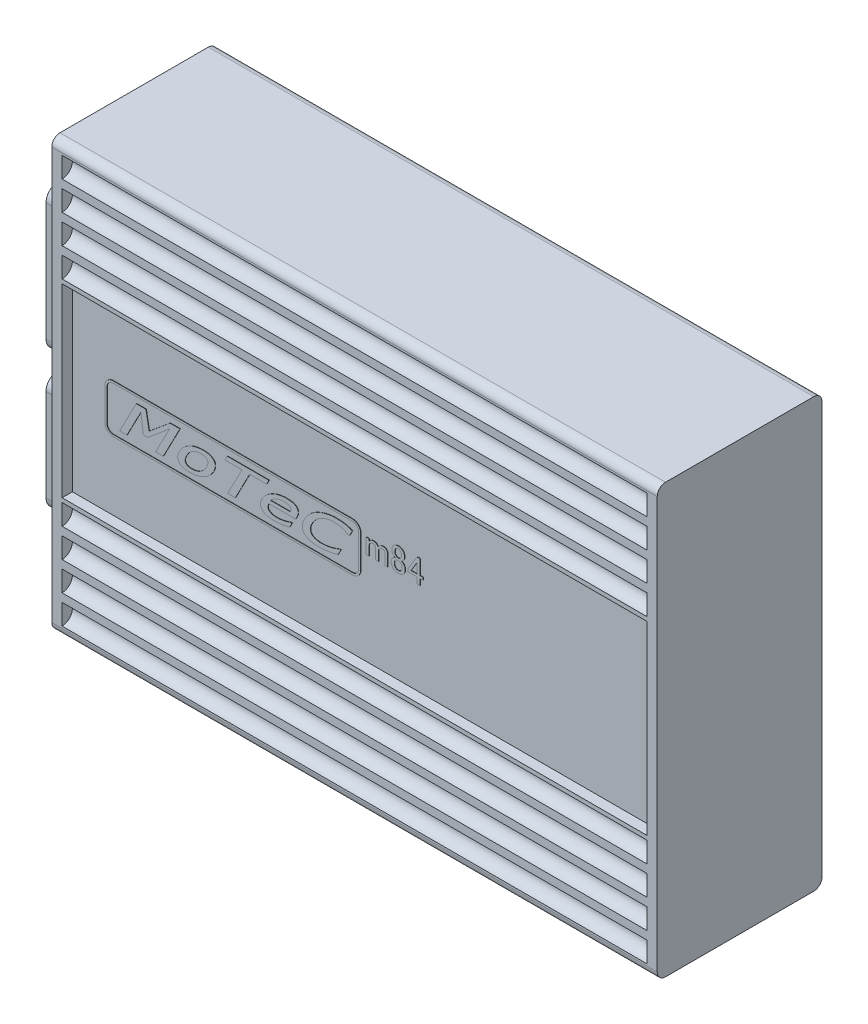
from build123d import *

# Parameters (mm, degrees)
SKETCH_1_W          = 147
SKETCH_1_H          = 104
EXTRUDE_1_DEPTH     = 40
FILLET_1_R          = 2
SKETCH_5_W          = 147
SKETCH_5_H          = 45
CUT_EXTRUDE_1_DEPTH = 2.5
CUT_EXTRUDE_2_DEPTH = 161.975153362
SKETCH_7_W          = 147
SKETCH_7_H          = 45
CUT_EXTRUDE_3_DEPTH = 2.5
EXTRUDE_4_DEPTH     = 2.5
EXTRUDE_5_DEPTH     = 2.5
EXTRUDE_6_DEPTH     = 0.1
EXTRUDE_7_DEPTH     = 0.1
SKETCH_12_W         = 23.8
SKETCH_12_H         = 34.7
SKETCH_12_H_2       = 28.4
EXTRUDE_8_DEPTH     = 7.4
SKETCH_14_W         = 19.8
SKETCH_14_H         = 30.7
CUT_EXTRUDE_4_DEPTH = 20
SKETCH_15_W         = 19.8
SKETCH_15_H         = 24.4
CUT_EXTRUDE_5_DEPTH = 20
FILLET_3_R          = 3


with BuildPart() as part:
    # ｽｹｯﾁ1 → ﾎﾞｽ - 押し出し1 (new body)
    with BuildSketch(Plane.XY):
        Rectangle(SKETCH_1_W, SKETCH_1_H)
    extrude(amount=EXTRUDE_1_DEPTH)

    # ﾌｨﾚｯﾄ1
    fillet_1_edges = [part.edges().sort_by_distance(p)[0] for p in [
        (0, -52, 40),
        (0, -52, 0),
        (0, 52, 0),
        (0, 52, 40),
    ]]
    fillet(fillet_1_edges, radius=FILLET_1_R)

    # ｽｹｯﾁ5 → ｶｯﾄ - 押し出し1 (cut)
    with BuildSketch(Plane(origin=(0, 0, 0), x_dir=(-1, 0, 0), z_dir=(0, 0, -1))):
        Rectangle(SKETCH_5_W, SKETCH_5_H)
    extrude(amount=-CUT_EXTRUDE_1_DEPTH, mode=Mode.SUBTRACT)

    # ｽｹｯﾁ6 → ｶｯﾄ - 押し出し2 (cut, through all)
    with BuildSketch(Plane.ZY.offset(73.5)):
        with BuildLine():
            Line((0, 49.5), (0, 44.5))
            ThreePointArc((0, 44.5), (2.5, 47), (0, 49.5))
        make_face()
        with BuildLine():
            Line((0, 42.5), (0, 37.5))
            ThreePointArc((0, 37.5), (2.5, 40), (0, 42.5))
        make_face()
        with BuildLine():
            Line((0, 35.5), (0, 30.5))
            ThreePointArc((0, 30.5), (2.5, 33), (0, 35.5))
        make_face()
        with BuildLine():
            Line((0, 28.5), (0, 23.5))
            ThreePointArc((0, 23.5), (2.5, 26), (0, 28.5))
        make_face()
        with BuildLine():
            Line((40, 28.5), (40, 23.5))
            ThreePointArc((40, 23.5), (37.5, 26), (40, 28.5))
        make_face()
        with BuildLine():
            Line((40, 35.5), (40, 30.5))
            ThreePointArc((40, 30.5), (37.5, 33), (40, 35.5))
        make_face()
        with BuildLine():
            Line((40, 42.5), (40, 37.5))
            ThreePointArc((40, 37.5), (37.5, 40), (40, 42.5))
        make_face()
        with BuildLine():
            Line((40, 49.5), (40, 44.5))
            ThreePointArc((40, 44.5), (37.5, 47), (40, 49.5))
        make_face()
    cut_extrude_2 = extrude(amount=-CUT_EXTRUDE_2_DEPTH, mode=Mode.SUBTRACT)

    # ﾐﾗｰ1: ｶｯﾄ - 押し出し2 across plane
    add(cut_extrude_2.mirror(Plane.ZX), mode=Mode.SUBTRACT)

    # ｽｹｯﾁ7 → ｶｯﾄ - 押し出し3 (cut)
    with BuildSketch(Plane.XY.offset(40)):
        Rectangle(SKETCH_7_W, SKETCH_7_H)
    extrude(amount=-CUT_EXTRUDE_3_DEPTH, mode=Mode.SUBTRACT)

    # ｽｹｯﾁ8 → ﾎﾞｽ - 押し出し4 (add)
    with BuildSketch(Plane.ZY.offset(73.5)):
        with BuildLine():
            Line((2, -52), (38, -52))
            ThreePointArc((38, -52), (39.414213562, -51.414213562), (40, -50))
            Line((40, -50), (40, 50))
            ThreePointArc((40, 50), (39.414213562, 51.414213562), (38, 52))
            Line((38, 52), (2, 52))
            ThreePointArc((2, 52), (0.585786438, 51.414213562), (0, 50))
            Line((0, 50), (0, -50))
            ThreePointArc((0, -50), (0.585786438, -51.414213562), (2, -52))
        make_face()
    extrude(amount=-EXTRUDE_4_DEPTH)

    # ｽｹｯﾁ9 → ﾎﾞｽ - 押し出し5 (add)
    with BuildSketch(Plane(origin=(73.5, 0, 0), x_dir=(0, 0, -1), z_dir=(1, 0, 0))):
        with BuildLine():
            Line((-38, -52), (-2, -52))
            ThreePointArc((-2, -52), (-0.585786438, -51.414213562), (0, -50))
            Line((0, -50), (0, 50))
            ThreePointArc((0, 50), (-0.585786438, 51.414213562), (-2, 52))
            Line((-2, 52), (-38, 52))
            ThreePointArc((-38, 52), (-39.414213562, 51.414213562), (-40, 50))
            Line((-40, 50), (-40, -50))
            ThreePointArc((-40, -50), (-39.414213562, -51.414213562), (-38, -52))
        make_face()
    extrude(amount=-EXTRUDE_5_DEPTH)

    # ｽｹｯﾁ11 → ﾎﾞｽ - 押し出し6 (add)
    # profile 1 of 3: a face of its own
    with BuildSketch(Plane.XY.offset(37.5)):
        with BuildLine():
            Line((1.144144144, 0.098069498), (0.447971781, 0.098069498))
            Line((0.447971781, 0.098069498), (0.447971781, 3.759330759))
            Line((0.447971781, 3.759330759), (1.144144144, 3.759330759))
            Line((1.144144144, 3.759330759), (1.144144144, 3.203603604))
            add(Edge.make_bspline(
                [(1.144144144, 3.203603604), (1.209094475, 3.300576984), (1.316490685, 3.432401394), (1.476128806, 3.58323051), (1.598188132, 3.67094831), (1.723684656, 3.739797755), (1.896496282, 3.805448376), (2.033643976, 3.824764595), (2.124839125, 3.824710425)],
                knots=[0, 0, 0, 0, 0.289076243, 0.420055779, 0.543346146, 0.660648957, 0.774006625, 1, 1, 1, 1], degree=3))
            add(Edge.make_bspline(
                [(2.124839125, 3.824710425), (2.222453162, 3.825502434), (2.365318527, 3.815397975), (2.547538805, 3.781292301), (2.671391328, 3.746176063), (2.785948421, 3.70006945), (2.925267534, 3.624888497), (3.018307002, 3.552522146), (3.072844273, 3.497812098)],
                knots=[0, 0, 0, 0, 0.284349585, 0.416050932, 0.539630879, 0.658870528, 0.775162342, 1, 1, 1, 1], degree=3))
            add(Edge.make_bspline(
                [(3.072844273, 3.497812098), (3.125910433, 3.444067838), (3.2249881, 3.332056492), (3.300695747, 3.203147761), (3.334362934, 3.138223938)],
                knots=[0, 0, 0, 0, 0.508065967, 1, 1, 1, 1], degree=3))
            add(Edge.make_bspline(
                [(3.334362934, 3.138223938), (3.400916793, 3.246117725), (3.514183942, 3.39515933), (3.69458124, 3.559539674), (3.839074417, 3.655319927), (3.992148203, 3.731705924), (4.213801324, 3.806649249), (4.391790494, 3.823489453), (4.511196911, 3.824710425)],
                knots=[0, 0, 0, 0, 0.26615625, 0.390354004, 0.51067604, 0.62890337, 0.748675196, 1, 1, 1, 1], degree=3))
            add(Edge.make_bspline(
                [(4.511196911, 3.824710425), (4.593711478, 3.823900393), (4.714964686, 3.817132519), (4.870108538, 3.785588746), (4.976339715, 3.753121766), (5.075851443, 3.711588521), (5.198084993, 3.644276204), (5.279657693, 3.578954386), (5.328442728, 3.530501931)],
                knots=[0, 0, 0, 0, 0.277853537, 0.406705624, 0.531658906, 0.650907513, 0.768780622, 1, 1, 1, 1], degree=3))
            add(Edge.make_bspline(
                [(5.328442728, 3.530501931), (5.38029412, 3.478665866), (5.451324968, 3.396653054), (5.528818936, 3.278355141), (5.576015875, 3.189084536), (5.610296883, 3.097212137), (5.645373484, 2.97259854), (5.655816367, 2.875985595), (5.655341055, 2.811325611)],
                knots=[0, 0, 0, 0, 0.271080785, 0.399344613, 0.522112387, 0.643458092, 0.761078932, 1, 1, 1, 1], degree=3))
            Line((5.655341055, 2.811325611), (5.655341055, 0.098069498))
            Line((5.655341055, 0.098069498), (4.959168693, 0.098069498))
            Line((4.959168693, 0.098069498), (4.959168693, 2.680566281))
            add(Edge.make_bspline(
                [(4.959168693, 2.680566281), (4.957533627, 2.740900528), (4.948967941, 2.856801651), (4.900941368, 2.962851102), (4.870785071, 3.007464607)],
                knots=[0, 0, 0, 0, 0.52989765, 1, 1, 1, 1], degree=3))
            add(Edge.make_bspline(
                [(4.870785071, 3.007464607), (4.810022588, 3.068517718), (4.669054485, 3.172179641), (4.496902642, 3.203775177), (4.413127413, 3.203603604)],
                knots=[0, 0, 0, 0, 0.507505966, 1, 1, 1, 1], degree=3))
            add(Edge.make_bspline(
                [(4.413127413, 3.203603604), (4.339831937, 3.202789794), (4.231484319, 3.195531115), (4.092740614, 3.164650864), (3.996262969, 3.130974916), (3.903905229, 3.090652477), (3.78820347, 3.021145215), (3.708921056, 2.957782376), (3.661261261, 2.909395109)],
                knots=[0, 0, 0, 0, 0.265314778, 0.391024086, 0.512886475, 0.634416216, 0.754827548, 1, 1, 1, 1], degree=3))
            add(Edge.make_bspline(
                [(3.661261261, 2.909395109), (3.587585708, 2.832970405), (3.459302835, 2.687846458), (3.401078827, 2.502381341), (3.3997426, 2.419047619)],
                knots=[0, 0, 0, 0, 0.564258034, 1, 1, 1, 1], degree=3))
            Line((3.3997426, 2.419047619), (3.3997426, 0.098069498))
            Line((3.3997426, 0.098069498), (2.703570237, 0.098069498))
            Line((2.703570237, 0.098069498), (2.703570237, 2.647876448))
            add(Edge.make_bspline(
                [(2.703570237, 2.647876448), (2.704140297, 2.715262391), (2.672005479, 2.85675132), (2.597820466, 2.981137348), (2.54980695, 3.04015444)],
                knots=[0, 0, 0, 0, 0.46824483, 1, 1, 1, 1], degree=3))
            add(Edge.make_bspline(
                [(2.54980695, 3.04015444), (2.493149542, 3.098007569), (2.334298815, 3.183611446), (2.155918243, 3.205201222), (2.059459459, 3.203603604)],
                knots=[0, 0, 0, 0, 0.453090255, 1, 1, 1, 1], degree=3))
            add(Edge.make_bspline(
                [(2.059459459, 3.203603604), (1.944729086, 3.205380493), (1.713210608, 3.159757499), (1.519279466, 3.025504849), (1.438352638, 2.942084942)],
                knots=[0, 0, 0, 0, 0.496525804, 1, 1, 1, 1], degree=3))
            add(Edge.make_bspline(
                [(1.438352638, 2.942084942), (1.35447241, 2.856242051), (1.212714539, 2.690331933), (1.143236289, 2.48177415), (1.144144144, 2.386357786)],
                knots=[0, 0, 0, 0, 0.561835364, 1, 1, 1, 1], degree=3))
            Line((1.144144144, 2.386357786), (1.144144144, 0.098069498))
        make_face()
    # profile 2 of 3: a face of its own
    with BuildSketch(Plane.XY.offset(37.5)):
        with BuildLine():
            Line((8.965489299, 3.007464607), (8.965489299, 2.942084942))
            add(Edge.make_bspline(
                [(8.965489299, 2.942084942), (9.066135435, 2.919951937), (9.27023082, 2.836416684), (9.439678289, 2.695712893), (9.521216455, 2.615186615)],
                knots=[0, 0, 0, 0, 0.472373328, 1, 1, 1, 1], degree=3))
            add(Edge.make_bspline(
                [(9.521216455, 2.615186615), (9.585452655, 2.550762147), (9.6733995, 2.444937025), (9.76191299, 2.284723735), (9.818308984, 2.157849235), (9.860034277, 2.021864576), (9.903959162, 1.826621272), (9.912857116, 1.673056413), (9.913494447, 1.569111969)],
                knots=[0, 0, 0, 0, 0.238093942, 0.356647629, 0.47758062, 0.60036302, 0.727832734, 1, 1, 1, 1], degree=3))
            add(Edge.make_bspline(
                [(9.913494447, 1.569111969), (9.913786048, 1.46355969), (9.899227581, 1.307421444), (9.852036974, 1.106434786), (9.802098975, 0.963401973), (9.736512725, 0.826947911), (9.629417916, 0.651184491), (9.53064566, 0.530730209), (9.455836789, 0.457657658)],
                knots=[0, 0, 0, 0, 0.256257606, 0.379192059, 0.500730937, 0.623508935, 0.746243874, 1, 1, 1, 1], degree=3))
            add(Edge.make_bspline(
                [(9.455836789, 0.457657658), (9.383864278, 0.387220625), (9.263851695, 0.291320196), (9.081262489, 0.195153101), (8.931205386, 0.136211677), (8.769402856, 0.088125697), (8.529433762, 0.045329772), (8.342131055, 0.030730599), (8.213623147, 0.032689833)],
                knots=[0, 0, 0, 0, 0.224285237, 0.339223886, 0.458168827, 0.582682974, 0.714302543, 1, 1, 1, 1], degree=3))
            add(Edge.make_bspline(
                [(8.213623147, 0.032689833), (8.085115239, 0.030730599), (7.897812532, 0.045329772), (7.657843437, 0.088125697), (7.496040908, 0.136211677), (7.345983804, 0.195153101), (7.163394599, 0.291320196), (7.043382016, 0.387220625), (6.971409505, 0.457657658)],
                knots=[0, 0, 0, 0, 0.285697457, 0.417317026, 0.541831173, 0.660776114, 0.775714763, 1, 1, 1, 1], degree=3))
            add(Edge.make_bspline(
                [(6.971409505, 0.457657658), (6.896430141, 0.530653978), (6.798155259, 0.651330647), (6.690351192, 0.826589026), (6.626994804, 0.963996337), (6.574754581, 1.106119498), (6.528357976, 1.307549811), (6.51328421, 1.463493083), (6.513751847, 1.569111969)],
                knots=[0, 0, 0, 0, 0.253779418, 0.376525622, 0.498895351, 0.620773136, 0.743718873, 1, 1, 1, 1], degree=3))
            add(Edge.make_bspline(
                [(6.513751847, 1.569111969), (6.514389178, 1.673056413), (6.523287132, 1.826621272), (6.567212017, 2.021864576), (6.60893731, 2.157849235), (6.665333304, 2.284723735), (6.753846794, 2.444937025), (6.841793639, 2.550762147), (6.906029839, 2.615186615)],
                knots=[0, 0, 0, 0, 0.272167266, 0.39963698, 0.52241938, 0.643352371, 0.761906058, 1, 1, 1, 1], degree=3))
            add(Edge.make_bspline(
                [(6.906029839, 2.615186615), (6.987568005, 2.695712893), (7.157015473, 2.836416684), (7.361110858, 2.919951937), (7.461756995, 2.942084942)],
                knots=[0, 0, 0, 0, 0.527626672, 1, 1, 1, 1], degree=3))
            Line((7.461756995, 2.942084942), (7.461756995, 3.007464607))
            add(Edge.make_bspline(
                [(7.461756995, 3.007464607), (7.387744142, 3.03094171), (7.236053687, 3.118292426), (7.105188692, 3.23352326), (7.03678917, 3.301673102)],
                knots=[0, 0, 0, 0, 0.444019688, 1, 1, 1, 1], degree=3))
            add(Edge.make_bspline(
                [(7.03678917, 3.301673102), (6.977518997, 3.35903046), (6.899662198, 3.454339857), (6.816093373, 3.593494288), (6.764652133, 3.701531415), (6.726085184, 3.815029485), (6.688063226, 3.975123666), (6.677701886, 4.09996308), (6.677201011, 4.184298584)],
                knots=[0, 0, 0, 0, 0.252388127, 0.374950703, 0.496630733, 0.618235357, 0.741494458, 1, 1, 1, 1], degree=3))
            add(Edge.make_bspline(
                [(6.677201011, 4.184298584), (6.676788162, 4.299513212), (6.691239733, 4.468775711), (6.738116282, 4.686684342), (6.789602145, 4.838044846), (6.853929919, 4.982268437), (6.959522519, 5.16413109), (7.05983462, 5.286997589), (7.134858668, 5.361132561)],
                knots=[0, 0, 0, 0, 0.266281071, 0.391515052, 0.514598345, 0.63533766, 0.756206788, 1, 1, 1, 1], degree=3))
            add(Edge.make_bspline(
                [(7.134858668, 5.361132561), (7.200211428, 5.425268726), (7.30730912, 5.513878349), (7.470524842, 5.602074303), (7.601082347, 5.658438456), (7.741930041, 5.700087781), (7.945320215, 5.743870165), (8.105241661, 5.752847284), (8.213623147, 5.753410553)],
                knots=[0, 0, 0, 0, 0.23339933, 0.350616063, 0.471182202, 0.594644589, 0.723765921, 1, 1, 1, 1], degree=3))
            add(Edge.make_bspline(
                [(8.213623147, 5.753410553), (8.323233931, 5.755112588), (8.48410633, 5.740416863), (8.691239122, 5.697387161), (8.834442306, 5.649365619), (8.970079151, 5.589872982), (9.141204679, 5.492779169), (9.254873969, 5.397392466), (9.325077458, 5.328442728)],
                knots=[0, 0, 0, 0, 0.268572808, 0.395225723, 0.51830846, 0.638475842, 0.758246691, 1, 1, 1, 1], degree=3))
            add(Edge.make_bspline(
                [(9.325077458, 5.328442728), (9.39418836, 5.257454785), (9.489224205, 5.142369257), (9.587427387, 4.968978387), (9.645880312, 4.829182396), (9.694048753, 4.68123385), (9.737365049, 4.466040863), (9.751796352, 4.298723305), (9.750045283, 4.184298584)],
                knots=[0, 0, 0, 0, 0.237237054, 0.354867339, 0.475588846, 0.599282908, 0.726563048, 1, 1, 1, 1], degree=3))
            add(Edge.make_bspline(
                [(9.750045283, 4.184298584), (9.74955551, 4.094804049), (9.739885167, 3.96123048), (9.696079163, 3.790830625), (9.654422111, 3.668504224), (9.597576308, 3.552468455), (9.508437451, 3.400715898), (9.420381221, 3.299951892), (9.357767291, 3.236293436)],
                knots=[0, 0, 0, 0, 0.255143643, 0.378267329, 0.499952309, 0.622215881, 0.745323495, 1, 1, 1, 1], degree=3))
            add(Edge.make_bspline(
                [(9.357767291, 3.236293436), (9.303144089, 3.184136782), (9.1835047, 3.085887304), (9.039239837, 3.029434866), (8.965489299, 3.007464607)],
                knots=[0, 0, 0, 0, 0.495336252, 1, 1, 1, 1], degree=3))
        make_face()
        with BuildLine():
            add(Edge.make_bspline(
                [(8.213623147, 5.164993565), (8.110867842, 5.164521396), (7.902597168, 5.130227617), (7.730163677, 5.008392673), (7.657895991, 4.936164736)],
                knots=[0, 0, 0, 0, 0.501620805, 1, 1, 1, 1], degree=3))
            add(Edge.make_bspline(
                [(7.657895991, 4.936164736), (7.612808635, 4.893560551), (7.557725294, 4.817587027), (7.49589241, 4.707898191), (7.459876828, 4.616407695), (7.430321328, 4.518987394), (7.405393845, 4.374142701), (7.394301605, 4.261879997), (7.39637733, 4.184298584)],
                knots=[0, 0, 0, 0, 0.226301537, 0.34299475, 0.461284975, 0.586435464, 0.716022688, 1, 1, 1, 1], degree=3))
            add(Edge.make_bspline(
                [(7.39637733, 4.184298584), (7.394045852, 4.111473652), (7.405887536, 4.005797818), (7.430016881, 3.869220684), (7.460596729, 3.776587561), (7.495856135, 3.688474606), (7.558042733, 3.581346623), (7.613986156, 3.507790863), (7.657895991, 3.465122265)],
                knots=[0, 0, 0, 0, 0.276895612, 0.405600582, 0.52837923, 0.648539863, 0.767199981, 1, 1, 1, 1], degree=3))
            add(Edge.make_bspline(
                [(7.657895991, 3.465122265), (7.728278551, 3.393840982), (7.889922669, 3.275872131), (8.086037652, 3.236181018), (8.180933314, 3.236293436)],
                knots=[0, 0, 0, 0, 0.514332654, 1, 1, 1, 1], degree=3))
            add(Edge.make_bspline(
                [(8.180933314, 3.236293436), (8.296842029, 3.235588362), (8.511158166, 3.259952083), (8.701882786, 3.362895066), (8.769350303, 3.432432432)],
                knots=[0, 0, 0, 0, 0.548332788, 1, 1, 1, 1], degree=3))
            add(Edge.make_bspline(
                [(8.769350303, 3.432432432), (8.813378155, 3.475979123), (8.871724326, 3.549944449), (8.930988181, 3.661115321), (8.967607122, 3.752101519), (8.99642492, 3.849788595), (9.024738233, 3.994040256), (9.031056052, 4.107031508), (9.030868964, 4.184298584)],
                knots=[0, 0, 0, 0, 0.227087098, 0.343044258, 0.461305242, 0.586424794, 0.716259043, 1, 1, 1, 1], degree=3))
            add(Edge.make_bspline(
                [(9.030868964, 4.184298584), (9.031056052, 4.26156566), (9.024738233, 4.374556912), (8.99642492, 4.518808574), (8.967607122, 4.61649565), (8.930988181, 4.707481847), (8.871724326, 4.818652719), (8.813378155, 4.892618046), (8.769350303, 4.936164736)],
                knots=[0, 0, 0, 0, 0.283740957, 0.413575206, 0.538694758, 0.656955742, 0.772912902, 1, 1, 1, 1], degree=3))
            add(Edge.make_bspline(
                [(8.769350303, 4.936164736), (8.697082617, 5.008392673), (8.524649126, 5.130227617), (8.316378452, 5.164521396), (8.213623147, 5.164993565)],
                knots=[0, 0, 0, 0, 0.498379195, 1, 1, 1, 1], degree=3))
        make_face(mode=Mode.SUBTRACT)
        with BuildLine():
            add(Edge.make_bspline(
                [(8.213623147, 2.680566281), (8.145962429, 2.681046709), (8.046278765, 2.673920041), (7.918540086, 2.646066966), (7.829961199, 2.616636254), (7.745712521, 2.580447266), (7.640074156, 2.520541136), (7.569862076, 2.46197437), (7.52713666, 2.419047619)],
                knots=[0, 0, 0, 0, 0.268893381, 0.395354554, 0.518591747, 0.639255943, 0.759203962, 1, 1, 1, 1], degree=3))
            add(Edge.make_bspline(
                [(7.52713666, 2.419047619), (7.482049304, 2.376443434), (7.426965963, 2.30046991), (7.365133079, 2.190781074), (7.329117498, 2.099290578), (7.299561997, 2.001870277), (7.274634514, 1.857025584), (7.263542274, 1.74476288), (7.265617999, 1.667181467)],
                knots=[0, 0, 0, 0, 0.226301537, 0.34299475, 0.461284975, 0.586435464, 0.716022688, 1, 1, 1, 1], degree=3))
            add(Edge.make_bspline(
                [(7.265617999, 1.667181467), (7.266126561, 1.58942892), (7.273747169, 1.474753095), (7.304399928, 1.327863505), (7.338042898, 1.226504419), (7.378246889, 1.130434986), (7.447817671, 1.011927586), (7.51021042, 0.930167129), (7.559826493, 0.882625483)],
                knots=[0, 0, 0, 0, 0.27113284, 0.399160129, 0.521947986, 0.642941682, 0.761423011, 1, 1, 1, 1], degree=3))
            add(Edge.make_bspline(
                [(7.559826493, 0.882625483), (7.601358672, 0.838829149), (7.672649282, 0.784676366), (7.772977226, 0.720832087), (7.853909294, 0.685561209), (7.937613727, 0.655060765), (8.058031115, 0.63097718), (8.15040425, 0.618838179), (8.213623147, 0.621106821)],
                knots=[0, 0, 0, 0, 0.248910688, 0.370594491, 0.491909555, 0.614155835, 0.739210138, 1, 1, 1, 1], degree=3))
            add(Edge.make_bspline(
                [(8.213623147, 0.621106821), (8.276842044, 0.618838179), (8.369215179, 0.63097718), (8.489632567, 0.655060765), (8.573337, 0.685561209), (8.654269068, 0.720832087), (8.754597012, 0.784676366), (8.825887622, 0.838829149), (8.867419801, 0.882625483)],
                knots=[0, 0, 0, 0, 0.260789862, 0.385844165, 0.508090445, 0.629405509, 0.751089312, 1, 1, 1, 1], degree=3))
            add(Edge.make_bspline(
                [(8.867419801, 0.882625483), (8.917035874, 0.930167129), (8.979428623, 1.011927586), (9.048999405, 1.130434986), (9.089203396, 1.226504419), (9.122846366, 1.327863505), (9.153499125, 1.474753095), (9.161119733, 1.58942892), (9.161628295, 1.667181467)],
                knots=[0, 0, 0, 0, 0.238576989, 0.357058318, 0.478052014, 0.600839871, 0.72886716, 1, 1, 1, 1], degree=3))
            add(Edge.make_bspline(
                [(9.161628295, 1.667181467), (9.161043884, 1.744907586), (9.153640483, 1.859659093), (9.122570958, 2.006807567), (9.089760557, 2.108475702), (9.048637066, 2.204176326), (8.979545266, 2.322483241), (8.916977183, 2.404171707), (8.867419801, 2.451737452)],
                knots=[0, 0, 0, 0, 0.271119923, 0.399141112, 0.523261622, 0.642958694, 0.761434378, 1, 1, 1, 1], degree=3))
            add(Edge.make_bspline(
                [(8.867419801, 2.451737452), (8.828359871, 2.488890771), (8.765094609, 2.541778648), (8.667480999, 2.591980355), (8.589286433, 2.626404048), (8.503274329, 2.648897037), (8.378417136, 2.674757886), (8.280335053, 2.680293399), (8.213623147, 2.680566281)],
                knots=[0, 0, 0, 0, 0.228211045, 0.343996016, 0.462270739, 0.587868715, 0.718101765, 1, 1, 1, 1], degree=3))
        make_face(mode=Mode.SUBTRACT)
    # profile 3 of 3: a face of its own
    with BuildSketch(Plane.XY.offset(37.5)):
        Polygon((12.790199724, 5.753410553), (13.542065875, 5.753410553), (13.542065875, 2.157528958), (14.228552362, 2.157528958), (14.228552362, 1.538843606), (13.542065875, 1.538843606), (13.542065875, 0.098069498), (12.768406502, 0.098069498), (12.768406502, 1.538843606), (10.599980933, 1.538843606), (10.599980933, 2.19021879), align=None)
        Polygon((12.768406502, 4.543886744), (11.319157252, 2.157528958), (12.768406502, 2.157528958), align=None, mode=Mode.SUBTRACT)
    extrude(amount=EXTRUDE_6_DEPTH)

    # ｽｹｯﾁ10 → ﾎﾞｽ - 押し出し7 (add)
    # profile 1 of 6: a face of its own
    with BuildSketch(Plane.XY.offset(37.5)):
        with BuildLine():
            Line((-61, 5.88), (-2.9, 5.88))
            ThreePointArc((-2.9, 5.88), (-1.485786438, 5.294213562), (-0.9, 3.88))
            Line((-0.9, 3.88), (-0.9, -3.88))
            ThreePointArc((-0.9, -3.88), (-1.485786438, -5.294213562), (-2.9, -5.88))
            Line((-2.9, -5.88), (-61, -5.88))
            ThreePointArc((-61, -5.88), (-62.414213562, -5.294213562), (-63, -3.88))
            Line((-63, -3.88), (-63, 3.88))
            ThreePointArc((-63, 3.88), (-62.414213562, 5.294213562), (-61, 5.88))
        make_face()
        with BuildLine():
            ThreePointArc((-61, 5.38), (-62.060660172, 4.940660172), (-62.5, 3.88))
            Line((-62.5, 3.88), (-62.5, -3.88))
            ThreePointArc((-62.5, -3.88), (-62.060660172, -4.940660172), (-61, -5.38))
            Line((-61, -5.38), (-2.9, -5.38))
            ThreePointArc((-2.9, -5.38), (-1.839339828, -4.940660172), (-1.4, -3.88))
            Line((-1.4, -3.88), (-1.4, 3.88))
            ThreePointArc((-1.4, 3.88), (-1.839339828, 4.940660172), (-2.9, 5.38))
            Line((-2.9, 5.38), (-61, 5.38))
        make_face(mode=Mode.SUBTRACT)
    # profile 2 of 6: a face of its own
    with BuildSketch(Plane.XY.offset(37.5)):
        with BuildLine():
            add(Edge.make_bspline(
                [(-10.448395745, -2.995822785), (-10.079179397, -2.996187373), (-9.525773747, -2.964212634), (-8.792674877, -2.86404899), (-8.243971261, -2.757517863), (-7.693297667, -2.620866814), (-6.948198135, -2.388578016), (-6.394778587, -2.177088425), (-6.030579729, -2.013403657)],
                knots=[0, 0, 0, 0, 0.242890256, 0.364218788, 0.486644916, 0.610525481, 0.737368127, 1, 1, 1, 1], degree=3))
            Line((-6.030579729, -2.013403657), (-5.700548303, -2.013403657))
            Line((-5.700548303, -2.013403657), (-6.394381813, -3.345809599))
            add(Edge.make_bspline(
                [(-6.394381813, -3.345809599), (-6.590242705, -3.397384232), (-6.87018769, -3.461750188), (-7.21853057, -3.555205198), (-7.442685771, -3.612850905), (-7.666129645, -3.670455885), (-8.016552606, -3.747591738), (-8.296305269, -3.804126621), (-8.494302699, -3.841624253)],
                knots=[0, 0, 0, 0, 0.281526267, 0.399181891, 0.50130773, 0.603257568, 0.719902735, 1, 1, 1, 1], degree=3))
            add(Edge.make_bspline(
                [(-8.494302699, -3.841624253), (-8.867616552, -3.907674957), (-9.344445406, -3.980351143), (-9.929627045, -4.040231597), (-10.361966942, -4.069046298), (-10.692400046, -4.075561986), (-10.916579861, -4.076483826)],
                knots=[0, 0, 0, 0, 0.46673198, 0.593333163, 0.724012956, 1, 1, 1, 1], degree=3))
            add(Edge.make_bspline(
                [(-10.916579861, -4.076483826), (-11.122414491, -4.078535393), (-11.425534132, -4.068608701), (-11.822058047, -4.044433816), (-12.102648038, -4.018677117), (-12.371739163, -3.984191548), (-12.63019263, -3.945698575), (-12.877078513, -3.895367156), (-13.113745668, -3.841559295), (-13.337518105, -3.776982337), (-13.548941178, -3.704344018), (-13.748449834, -3.625521713), (-13.934882104, -3.536653533), (-14.107299412, -3.43715888), (-14.320305345, -3.299331199), (-14.463169981, -3.176704099), (-14.551530635, -3.090994638)],
                knots=[0, 0, 0, 0, 0.16014093, 0.235947779, 0.309130297, 0.379362033, 0.447054338, 0.512416962, 0.575391442, 0.635884882, 0.693557866, 0.749310158, 0.802740376, 0.854105346, 0.904134877, 1, 1, 1, 1], degree=3))
            add(Edge.make_bspline(
                [(-14.551530635, -3.090994638), (-14.633217917, -3.008069116), (-14.745140542, -2.874676948), (-14.866480132, -2.677487152), (-14.939228115, -2.520302236), (-14.999759436, -2.355726031), (-15.0444953, -2.182448701), (-15.072885482, -2.000438121), (-15.088767489, -1.810092976), (-15.087181611, -1.611230376), (-15.066124716, -1.404501519), (-15.029292384, -1.190087105), (-14.974827537, -0.967548374), (-14.902804451, -0.737749201), (-14.776669109, -0.412979257), (-14.663666464, -0.169940532), (-14.579161173, -0.007119594)],
                knots=[0, 0, 0, 0, 0.105346759, 0.156890264, 0.209093138, 0.261831399, 0.315406748, 0.370753984, 0.4283623, 0.488101386, 0.55044541, 0.616222302, 0.684847226, 0.757639184, 0.834008045, 1, 1, 1, 1], degree=3))
            add(Edge.make_bspline(
                [(-14.579161173, -0.007119594), (-14.495094558, 0.154901889), (-14.358127816, 0.391745943), (-14.156906957, 0.695436636), (-13.997291588, 0.917191818), (-13.826514111, 1.131700419), (-13.647310786, 1.340595885), (-13.457758735, 1.542354233), (-13.19132728, 1.802228023), (-12.83619764, 2.109922673), (-12.225445347, 2.569916397), (-11.723916276, 2.858626435), (-11.378623857, 3.033774613)],
                knots=[0, 0, 0, 0, 0.121977628, 0.182680008, 0.243424758, 0.304523679, 0.365874737, 0.427325789, 0.489476058, 0.614555059, 0.741086083, 1, 1, 1, 1], degree=3))
            add(Edge.make_bspline(
                [(-11.378623857, 3.033774613), (-11.033615813, 3.204914177), (-10.495976163, 3.434259642), (-9.745309965, 3.668048122), (-9.156733015, 3.817363836), (-8.550664434, 3.932456099), (-7.720378104, 4.047670091), (-7.088270185, 4.075839827), (-6.664547073, 4.077594937)],
                knots=[0, 0, 0, 0, 0.237239243, 0.359144459, 0.483967525, 0.611048753, 0.738923559, 1, 1, 1, 1], degree=3))
            add(Edge.make_bspline(
                [(-6.664547073, 4.077594937), (-6.352067232, 4.078369967), (-5.888251071, 4.059286795), (-5.27926166, 3.995027295), (-4.831610234, 3.929170846), (-4.377415771, 3.835537654), (-3.727646597, 3.663247848), (-3.237244569, 3.490019419), (-2.905258878, 3.359200949)],
                knots=[0, 0, 0, 0, 0.243327498, 0.36112692, 0.476764065, 0.595548033, 0.722064397, 1, 1, 1, 1], degree=3))
            Line((-2.905258878, 3.359200949), (-3.605232507, 2.014514768))
            Line((-3.605232507, 2.014514768), (-3.947544172, 2.014514768))
            add(Edge.make_bspline(
                [(-3.947544172, 2.014514768), (-4.177146226, 2.183957615), (-4.541564234, 2.408397331), (-5.061369354, 2.638192321), (-5.467852611, 2.7720783), (-5.896720071, 2.874010356), (-6.523243469, 2.970775053), (-7.011661092, 2.999053975), (-7.346100343, 2.996933896)],
                knots=[0, 0, 0, 0, 0.237578322, 0.354907119, 0.472535721, 0.593451409, 0.721574043, 1, 1, 1, 1], degree=3))
            add(Edge.make_bspline(
                [(-7.346100343, 2.996933896), (-7.621949045, 2.997863328), (-8.031099915, 2.975468234), (-8.566452662, 2.901599421), (-8.954218141, 2.823209106), (-9.336820976, 2.718470985), (-9.85530051, 2.545688741), (-10.231849012, 2.367986983), (-10.482166403, 2.241699191)],
                knots=[0, 0, 0, 0, 0.253905673, 0.376619063, 0.497273574, 0.617832409, 0.741623353, 1, 1, 1, 1], degree=3))
            add(Edge.make_bspline(
                [(-10.482166403, 2.241699191), (-10.704493449, 2.126068975), (-11.027950501, 1.922713913), (-11.431738386, 1.602530666), (-11.729562315, 1.333163989), (-12.011448852, 1.036529209), (-12.362096425, 0.600626761), (-12.584459411, 0.240209168), (-12.715634889, -0.011724684)],
                knots=[0, 0, 0, 0, 0.233293165, 0.354755673, 0.479581918, 0.607001034, 0.735457672, 1, 1, 1, 1], degree=3))
            add(Edge.make_bspline(
                [(-12.715634889, -0.011724684), (-12.781690035, -0.139091602), (-12.872512488, -0.32742162), (-12.967173228, -0.580347996), (-13.025682692, -0.755333013), (-13.066511139, -0.92392189), (-13.095085647, -1.084859906), (-13.109216377, -1.237905544), (-13.109162008, -1.427310302), (-13.0816473, -1.645156811), (-13.00274303, -1.955394951), (-12.886289155, -2.158190153), (-12.786246264, -2.268218618)],
                knots=[0, 0, 0, 0, 0.179368759, 0.260703803, 0.337327084, 0.409738049, 0.477214235, 0.541403107, 0.601497754, 0.713544005, 0.814808748, 1, 1, 1, 1], degree=3))
            add(Edge.make_bspline(
                [(-12.786246264, -2.268218618), (-12.666069261, -2.398894104), (-12.449610694, -2.567287825), (-12.114849289, -2.732454528), (-11.828540344, -2.830458849), (-11.515674278, -2.90451293), (-11.054502483, -2.977248061), (-10.694489656, -2.995954748), (-10.448395745, -2.995822785)],
                knots=[0, 0, 0, 0, 0.211162598, 0.323577214, 0.443787782, 0.571197435, 0.706507481, 1, 1, 1, 1], degree=3))
        make_face()
    # profile 3 of 6: a face of its own
    with BuildSketch(Plane.XY.offset(37.5)):
        with BuildLine():
            add(Edge.make_bspline(
                [(-18.889525097, 2.210998594), (-18.60477977, 2.209924417), (-18.194297659, 2.195670597), (-17.675862792, 2.119141938), (-17.341652967, 2.043833874), (-17.044484812, 1.946111999), (-16.784301239, 1.827264326), (-16.560837469, 1.685444412), (-16.376296559, 1.520729917), (-16.230721821, 1.335897955), (-16.125342258, 1.132374051), (-16.061965997, 0.911251376), (-16.04094831, 0.673378747), (-16.063787098, 0.420539935), (-16.147079479, 0.042704972), (-16.270496521, -0.236140982), (-16.367470992, -0.423112693)],
                knots=[0, 0, 0, 0, 0.180061578, 0.258846571, 0.330845668, 0.396281307, 0.45616824, 0.511145229, 0.562886747, 0.611717904, 0.659003582, 0.706790651, 0.756143512, 0.809012237, 0.866596122, 1, 1, 1, 1], degree=3))
            Line((-16.367470992, -0.423112693), (-16.683687148, -1.030984529))
            Line((-16.683687148, -1.030984529), (-23.167653393, -1.030984529))
            add(Edge.make_bspline(
                [(-23.167653393, -1.030984529), (-23.239045695, -1.170750272), (-23.32727788, -1.383767298), (-23.380041029, -1.675602888), (-23.383605189, -1.877861747), (-23.355841861, -2.064018905), (-23.289796671, -2.283535522), (-23.191587723, -2.421304905), (-23.112392317, -2.493868012)],
                knots=[0, 0, 0, 0, 0.300431922, 0.436418863, 0.564514619, 0.685087292, 0.794857444, 1, 1, 1, 1], degree=3))
            add(Edge.make_bspline(
                [(-23.112392317, -2.493868012), (-23.017106051, -2.585340569), (-22.847226727, -2.697817011), (-22.59319373, -2.813353247), (-22.3737017, -2.881025083), (-22.131137251, -2.932772502), (-21.761677101, -2.982250531), (-21.471300793, -2.996426876), (-21.270356452, -2.995822785)],
                knots=[0, 0, 0, 0, 0.202000042, 0.310704826, 0.427794016, 0.554063925, 0.691352201, 1, 1, 1, 1], degree=3))
            add(Edge.make_bspline(
                [(-21.270356452, -2.995822785), (-20.964540971, -2.996351585), (-20.496588285, -2.965119075), (-19.865715762, -2.869739864), (-19.457827855, -2.786959558), (-19.13346856, -2.712432469), (-18.904038649, -2.653717157), (-18.689552245, -2.596750102), (-18.490382219, -2.54135477), (-18.30748619, -2.481383404), (-18.09166102, -2.411253056), (-17.941072152, -2.348400585), (-17.845704773, -2.308129395)],
                knots=[0, 0, 0, 0, 0.261144907, 0.399927876, 0.544803449, 0.616587433, 0.684225858, 0.747100479, 0.806182116, 0.860786439, 0.911516199, 1, 1, 1, 1], degree=3))
            Line((-17.845704773, -2.308129395), (-17.544838915, -2.308129395))
            Line((-17.544838915, -2.308129395), (-18.151175721, -3.47168205))
            add(Edge.make_bspline(
                [(-18.151175721, -3.47168205), (-18.474999785, -3.5471826), (-18.951589617, -3.651250315), (-19.575822922, -3.771291324), (-20.016721088, -3.846359712), (-20.449119971, -3.906190322), (-21.027155845, -3.960643597), (-21.463383081, -3.980262515), (-21.755425897, -3.978241913)],
                knots=[0, 0, 0, 0, 0.273424221, 0.40108227, 0.522686273, 0.641160734, 0.759937403, 1, 1, 1, 1], degree=3))
            add(Edge.make_bspline(
                [(-21.755425897, -3.978241913), (-21.932522026, -3.978175739), (-22.192706898, -3.972760963), (-22.531903598, -3.952043353), (-22.770440248, -3.930529972), (-22.998323927, -3.903386067), (-23.215849336, -3.869236355), (-23.423052497, -3.830301416), (-23.618842141, -3.782149459), (-23.804424163, -3.730137152), (-23.979235015, -3.672079096), (-24.143831149, -3.607751008), (-24.297600649, -3.53705869), (-24.44133878, -3.460737231), (-24.57280593, -3.375764808), (-24.69508446, -3.286983048), (-24.805898904, -3.191427097), (-24.905737858, -3.09091846), (-24.992628074, -2.983954313), (-25.066804499, -2.871394669), (-25.128207709, -2.752932459), (-25.177473233, -2.629530851), (-25.21516928, -2.501205556), (-25.237438823, -2.367207206), (-25.248277149, -2.228006783), (-25.246452958, -2.083691882), (-25.232289622, -1.933856468), (-25.205890564, -1.778990483), (-25.167662563, -1.61875098), (-25.114349333, -1.454135143), (-25.025860829, -1.220649575), (-24.944424289, -1.04629545), (-24.883816807, -0.929672556)],
                knots=[0, 0, 0, 0, 0.093747242, 0.137709112, 0.179862389, 0.220513058, 0.259165551, 0.296402809, 0.332074397, 0.365856313, 0.398403907, 0.429537986, 0.459351621, 0.48795078, 0.515600453, 0.54214553, 0.567880939, 0.592971147, 0.617040608, 0.640704323, 0.664206276, 0.687543773, 0.710945624, 0.734857602, 0.759308086, 0.784769806, 0.811155493, 0.838896552, 0.867867806, 0.898277128, 0.93042215, 1, 1, 1, 1], degree=3))
            add(Edge.make_bspline(
                [(-24.883816807, -0.929672556), (-24.759634503, -0.688909353), (-24.540039842, -0.345081186), (-24.196678786, 0.07791408), (-23.908400728, 0.373992337), (-23.593088004, 0.651796367), (-23.250662832, 0.911377369), (-22.879017719, 1.150739802), (-22.483204579, 1.370818459), (-22.068266768, 1.566670414), (-21.641635427, 1.739712522), (-21.20594883, 1.885666555), (-20.760110282, 2.003549414), (-20.305801992, 2.097948472), (-19.682522184, 2.186328761), (-19.20779747, 2.209326191), (-18.889525097, 2.210998594)],
                knots=[0, 0, 0, 0, 0.114335128, 0.171789617, 0.229874067, 0.288677131, 0.349154139, 0.411204677, 0.475255755, 0.540322812, 0.604902689, 0.669629971, 0.734273837, 0.799595995, 0.865528919, 1, 1, 1, 1], degree=3))
        make_face()
        with BuildLine():
            add(Edge.make_bspline(
                [(-19.511212201, 1.228579466), (-19.690123559, 1.229647577), (-19.955060515, 1.215800602), (-20.30236549, 1.172977788), (-20.551890039, 1.126925621), (-20.794153599, 1.068104309), (-21.028891884, 0.998421774), (-21.255862333, 0.913254147), (-21.473046179, 0.815487601), (-21.679629663, 0.709737827), (-21.872423429, 0.599933656), (-22.050252038, 0.48635943), (-22.211346336, 0.367340293), (-22.35971273, 0.247314558), (-22.530565475, 0.081324228), (-22.643567995, -0.052034719), (-22.707144427, -0.146807314)],
                knots=[0, 0, 0, 0, 0.148912671, 0.220619962, 0.291229188, 0.360047186, 0.428112038, 0.494978369, 0.5617238, 0.626314759, 0.688140483, 0.746400746, 0.801873038, 0.854839704, 0.905156336, 1, 1, 1, 1], degree=3))
            Line((-22.707144427, -0.146807314), (-17.991532613, -0.146807314))
            add(Edge.make_bspline(
                [(-17.991532613, -0.146807314), (-17.946100069, -0.055525731), (-17.886471474, 0.081520823), (-17.852723149, 0.269192994), (-17.844697683, 0.397479407), (-17.86067105, 0.519571647), (-17.896378049, 0.63491486), (-17.952522645, 0.743416021), (-18.02883297, 0.845104429), (-18.129205545, 0.936459845), (-18.253370059, 1.016804602), (-18.40337976, 1.081369255), (-18.576292006, 1.137379193), (-18.775327106, 1.176555571), (-19.088500591, 1.2199414), (-19.337647477, 1.228096383), (-19.511212201, 1.228579466)],
                knots=[0, 0, 0, 0, 0.116957008, 0.168661705, 0.21723188, 0.263196383, 0.308490764, 0.354499842, 0.402078648, 0.452957402, 0.508727826, 0.570212028, 0.638975194, 0.716010132, 0.801565692, 1, 1, 1, 1], degree=3))
        make_face(mode=Mode.SUBTRACT)
    # profile 4 of 6: a face of its own
    with BuildSketch(Plane.XY.offset(37.5)):
        Polygon((-23.166118363, 3.881111111), (-23.727939302, 2.80045007), (-27.85409964, 2.80045007), (-31.330942335, -3.88), (-33.197538678, -3.88), (-29.720695983, 2.80045007), (-33.84685632, 2.80045007), (-33.285035382, 3.881111111), align=None)
    # profile 5 of 6: a face of its own
    with BuildSketch(Plane.XY.offset(37.5)):
        with BuildLine():
            add(Edge.make_bspline(
                [(-39.159594761, 2.210998594), (-39.00546659, 2.211988768), (-38.778481568, 2.204438716), (-38.482847085, 2.181673885), (-38.275304686, 2.159404462), (-38.077803336, 2.128014625), (-37.889780953, 2.091685181), (-37.710733433, 2.049097058), (-37.541919518, 1.997994019), (-37.381615208, 1.941757694), (-37.231500031, 1.877356965), (-37.091168485, 1.806370061), (-36.959786995, 1.729873127), (-36.838660089, 1.645038662), (-36.72625911, 1.554886392), (-36.623965297, 1.457387415), (-36.532496973, 1.353310663), (-36.450095106, 1.243925211), (-36.380261317, 1.128772568), (-36.319212031, 1.010316665), (-36.271874959, 0.886544043), (-36.234947043, 0.758687568), (-36.208482907, 0.626771788), (-36.195213279, 0.490043445), (-36.191728476, 0.348874175), (-36.201665726, 0.203177602), (-36.221723951, 0.053449253), (-36.253119823, -0.100704773), (-36.29382183, -0.259979352), (-36.348751567, -0.422942833), (-36.436396353, -0.652167339), (-36.519112652, -0.821594549), (-36.57767449, -0.935812676)],
                knots=[0, 0, 0, 0, 0.08746858, 0.128831776, 0.168279756, 0.205904567, 0.242299888, 0.276956138, 0.310308955, 0.342367171, 0.373331995, 0.402944872, 0.431584765, 0.459540617, 0.486799907, 0.513298249, 0.53963536, 0.565366642, 0.590918654, 0.615985791, 0.640902747, 0.665995106, 0.691454527, 0.717144802, 0.743869758, 0.771514635, 0.799937247, 0.829554397, 0.860759351, 0.893178606, 0.927103098, 1, 1, 1, 1], degree=3))
            add(Edge.make_bspline(
                [(-36.57767449, -0.935812676), (-36.700871405, -1.172950174), (-36.915233448, -1.513455133), (-37.251344422, -1.931715888), (-37.530165515, -2.227803741), (-37.837207445, -2.504077884), (-38.169271725, -2.764025707), (-38.528306158, -3.005714167), (-38.912177978, -3.226284938), (-39.313191436, -3.426468773), (-39.72770499, -3.601254706), (-40.153616941, -3.7457409), (-40.588713856, -3.868434952), (-41.034925672, -3.961894975), (-41.648991068, -4.050011322), (-42.117441186, -4.076242715), (-42.432278481, -4.076483826)],
                knots=[0, 0, 0, 0, 0.114859932, 0.17245018, 0.230506329, 0.28954477, 0.349887316, 0.411704423, 0.475482654, 0.540129373, 0.604325221, 0.668755915, 0.733402635, 0.798605219, 0.864633011, 1, 1, 1, 1], degree=3))
            add(Edge.make_bspline(
                [(-42.432278481, -4.076483826), (-42.583409613, -4.078335973), (-42.805554562, -4.068322198), (-43.095325788, -4.049410079), (-43.298475368, -4.025588007), (-43.492271074, -3.997294307), (-43.676493506, -3.96001046), (-43.851756425, -3.917358924), (-44.01768721, -3.868079316), (-44.17462678, -3.813815414), (-44.321076555, -3.749668229), (-44.45907122, -3.68166339), (-44.587023892, -3.605785504), (-44.706179982, -3.524582941), (-44.815082745, -3.435213389), (-44.915196388, -3.339840119), (-45.006272564, -3.238733249), (-45.085757602, -3.130933459), (-45.156150081, -3.018726941), (-45.211804916, -2.900122611), (-45.259601128, -2.778023338), (-45.291704143, -2.649872932), (-45.318229245, -2.517920333), (-45.326856815, -2.38042578), (-45.329700005, -2.238875197), (-45.31794059, -2.092654673), (-45.296136186, -1.941491383), (-45.264258089, -1.784887715), (-45.218827038, -1.623799805), (-45.163875836, -1.457480864), (-45.070682645, -1.225290605), (-44.988603945, -1.05178112), (-44.928237078, -0.935812676)],
                knots=[0, 0, 0, 0, 0.086489674, 0.127322392, 0.166247745, 0.203583539, 0.239440247, 0.27383539, 0.30683958, 0.338532732, 0.368849725, 0.398332612, 0.426573631, 0.453962779, 0.480824965, 0.507144752, 0.533083405, 0.558633561, 0.583760195, 0.608790978, 0.633551056, 0.658710128, 0.6843408, 0.710498626, 0.737456522, 0.765367296, 0.794373142, 0.824886309, 0.856803501, 0.89015958, 0.925144959, 1, 1, 1, 1], degree=3))
            add(Edge.make_bspline(
                [(-44.928237078, -0.935812676), (-44.802194646, -0.695485273), (-44.587668932, -0.348212742), (-44.248917808, 0.076374008), (-43.970222073, 0.375036197), (-43.666815494, 0.653550546), (-43.338216908, 0.912372323), (-42.984267559, 1.151551825), (-42.608107411, 1.371956451), (-42.213823216, 1.568285607), (-41.807869781, 1.741676561), (-41.390271828, 1.885115125), (-40.963734481, 2.005920038), (-40.526596705, 2.097281581), (-39.926243357, 2.187189784), (-39.467575284, 2.208925069), (-39.159594761, 2.210998594)],
                knots=[0, 0, 0, 0, 0.117897486, 0.176741251, 0.235720478, 0.29518905, 0.355492235, 0.417269957, 0.480633438, 0.54475391, 0.608501468, 0.672263364, 0.736446612, 0.800970781, 0.866139985, 1, 1, 1, 1], degree=3))
        make_face()
        with BuildLine():
            add(Edge.make_bspline(
                [(-41.921113528, -3.094064698), (-41.733117707, -3.091777648), (-41.453103595, -3.079567137), (-41.087745555, -3.019516941), (-40.822492688, -2.963010001), (-40.564872543, -2.884995525), (-40.314840436, -2.791280854), (-40.070649856, -2.682250744), (-39.834858055, -2.554704902), (-39.607349646, -2.411096949), (-39.392358009, -2.248654472), (-39.187134897, -2.072349003), (-38.995006947, -1.877599701), (-38.813453589, -1.667212268), (-38.585187001, -1.359551089), (-38.437683103, -1.108822428), (-38.346028921, -0.935812676)],
                knots=[0, 0, 0, 0, 0.128096444, 0.190163705, 0.251851658, 0.312564496, 0.37317836, 0.43350639, 0.494434615, 0.55549707, 0.6164452, 0.67768023, 0.739493896, 0.80246622, 0.866688739, 1, 1, 1, 1], degree=3))
            add(Edge.make_bspline(
                [(-38.346028921, -0.935812676), (-38.257423097, -0.770397044), (-38.148926606, -0.524845849), (-38.045744643, -0.200175027), (-38.004927886, 0.014276802), (-37.992628014, 0.211041828), (-38.009445787, 0.39126432), (-38.059724072, 0.553583647), (-38.13692675, 0.69944136), (-38.244774006, 0.824881714), (-38.374693713, 0.93541714), (-38.531570007, 1.025499833), (-38.711333092, 1.101171213), (-38.916704645, 1.158427581), (-39.237925433, 1.214699452), (-39.493204044, 1.230468797), (-39.670759713, 1.228579466)],
                knots=[0, 0, 0, 0, 0.165350846, 0.236136097, 0.299935477, 0.357320221, 0.409485736, 0.458577641, 0.506215473, 0.553930155, 0.603551996, 0.655935565, 0.71274815, 0.775154038, 0.843472183, 1, 1, 1, 1], degree=3))
            add(Edge.make_bspline(
                [(-39.670759713, 1.228579466), (-39.852900821, 1.229744889), (-40.123407647, 1.212631101), (-40.477281071, 1.159743913), (-40.732778015, 1.102950438), (-40.98067627, 1.028563057), (-41.221784635, 0.939703685), (-41.45605929, 0.835352179), (-41.682098947, 0.713437385), (-41.901294032, 0.575547685), (-42.110007027, 0.417016216), (-42.308985405, 0.238803728), (-42.49986544, 0.042704676), (-42.678801423, -0.175496497), (-42.913112245, -0.493849211), (-43.065254962, -0.754876013), (-43.159882648, -0.935812676)],
                knots=[0, 0, 0, 0, 0.125748445, 0.186878742, 0.246987004, 0.306363486, 0.365516557, 0.424367952, 0.483348674, 0.542766164, 0.603061162, 0.664139332, 0.727124419, 0.791879397, 0.858893322, 1, 1, 1, 1], degree=3))
            add(Edge.make_bspline(
                [(-43.159882648, -0.935812676), (-43.244424577, -1.102414596), (-43.358294071, -1.34530225), (-43.459520742, -1.669688858), (-43.502161684, -1.883259918), (-43.51792828, -2.079396343), (-43.50358308, -2.25921489), (-43.459061198, -2.421441047), (-43.385541691, -2.566311886), (-43.283558288, -2.691452796), (-43.158167991, -2.800417171), (-43.009632532, -2.892941607), (-42.836568078, -2.965573791), (-42.641673518, -3.024287624), (-42.335034659, -3.080017184), (-42.09107058, -3.096013857), (-41.921113528, -3.094064698)],
                knots=[0, 0, 0, 0, 0.168476385, 0.240795486, 0.305611238, 0.36429741, 0.417505527, 0.467272093, 0.51489189, 0.562763109, 0.611761689, 0.663943666, 0.719686907, 0.780349117, 0.846975261, 1, 1, 1, 1], degree=3))
        make_face(mode=Mode.SUBTRACT)
    # profile 6 of 6: a face of its own
    with BuildSketch(Plane.XY.offset(37.5)):
        Polygon((-44.779339179, 3.881111111), (-48.818002813, -3.88), (-50.684599156, -3.88), (-47.295253165, 2.634666842), (-52.574220948, -1.816919831), (-53.667162227, -1.816919831), (-54.270428973, 2.634666842), (-57.659774965, -3.88), (-59.428129395, -3.88), (-55.389465761, 3.881111111), (-53.036264944, 3.881111111), (-52.26414491, -0.346361199), (-47.192406162, 3.881111111), align=None)
    extrude(amount=EXTRUDE_7_DEPTH)

    # ｽｹｯﾁ12 → ﾎﾞｽ - 押し出し8 (add)
    with BuildSketch(Plane.ZY.offset(73.5)):
        with Locations((22.1, 17.25)):
            Rectangle(SKETCH_12_W, SKETCH_12_H)
        with Locations((22.1, -19.3)):
            Rectangle(SKETCH_12_W, SKETCH_12_H_2)
    extrude(amount=EXTRUDE_8_DEPTH)

    # ｽｹｯﾁ14 → ｶｯﾄ - 押し出し4 (cut)
    with BuildSketch(Plane.ZY.offset(80.9)):
        with Locations((22.1, 17.25)):
            Rectangle(SKETCH_14_W, SKETCH_14_H)
    extrude(amount=-CUT_EXTRUDE_4_DEPTH, mode=Mode.SUBTRACT)

    # ｽｹｯﾁ15 → ｶｯﾄ - 押し出し5 (cut)
    with BuildSketch(Plane.ZY.offset(80.9)):
        with Locations((22.1, -19.3)):
            Rectangle(SKETCH_15_W, SKETCH_15_H)
    extrude(amount=-CUT_EXTRUDE_5_DEPTH, mode=Mode.SUBTRACT)

    # ﾌｨﾚｯﾄ3
    fillet_3_edges = [part.edges().sort_by_distance(p)[0] for p in [
        (-77.2, 34.6, 10.2),
        (-77.2, -0.1, 10.2),
        (-77.2, -0.1, 34),
        (-77.2, 34.6, 34),
        (-77.2, -5.1, 10.2),
        (-77.2, -33.5, 10.2),
        (-77.2, -33.5, 34),
        (-77.2, -5.1, 34),
        (-70.9, 32.6, 12.2),
        (-70.9, 32.6, 32),
        (-70.9, 1.9, 32),
        (-70.9, 1.9, 12.2),
        (-70.9, -7.1, 12.2),
        (-70.9, -7.1, 32),
        (-70.9, -31.5, 32),
        (-70.9, -31.5, 12.2),
    ]]
    fillet(fillet_3_edges, radius=FILLET_3_R)


solid = part.part
